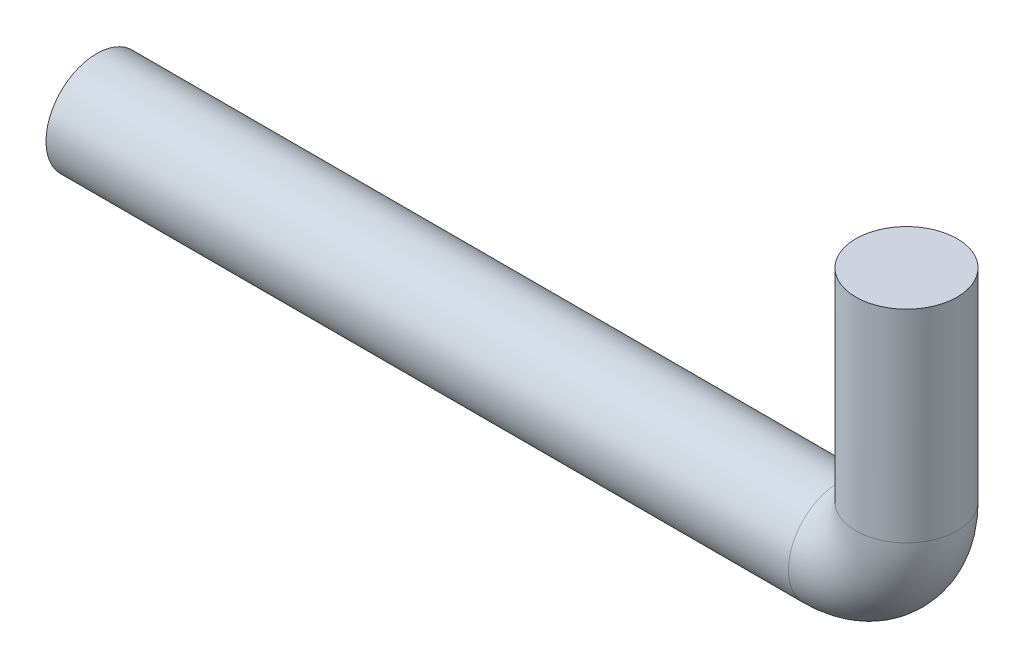
from build123d import *

# Parameters (mm, degrees)
SWEEP5_PROFILE_R = 9.525


with BuildPart() as part:
    # Sweep5: sweep along a path in Sketch1
    with BuildLine(Plane.XY) as sweep5_path:
        Line((0, 50.8), (0, 12.7))
        ThreePointArc((0, 12.7), (-3.719743879, 3.719743879), (-12.7, 0))
        Line((-12.7, 0), (-152.4, 0))
    # Sweep5 profile (on start of the path) → Sweep5 (sweep)
    with BuildSketch(Plane(origin=(0, 50.8, 0), x_dir=(0, 0, -1), z_dir=(0, -1, 0))):
        Circle(SWEEP5_PROFILE_R)
    sweep(path=sweep5_path.line)


solid = part.part
